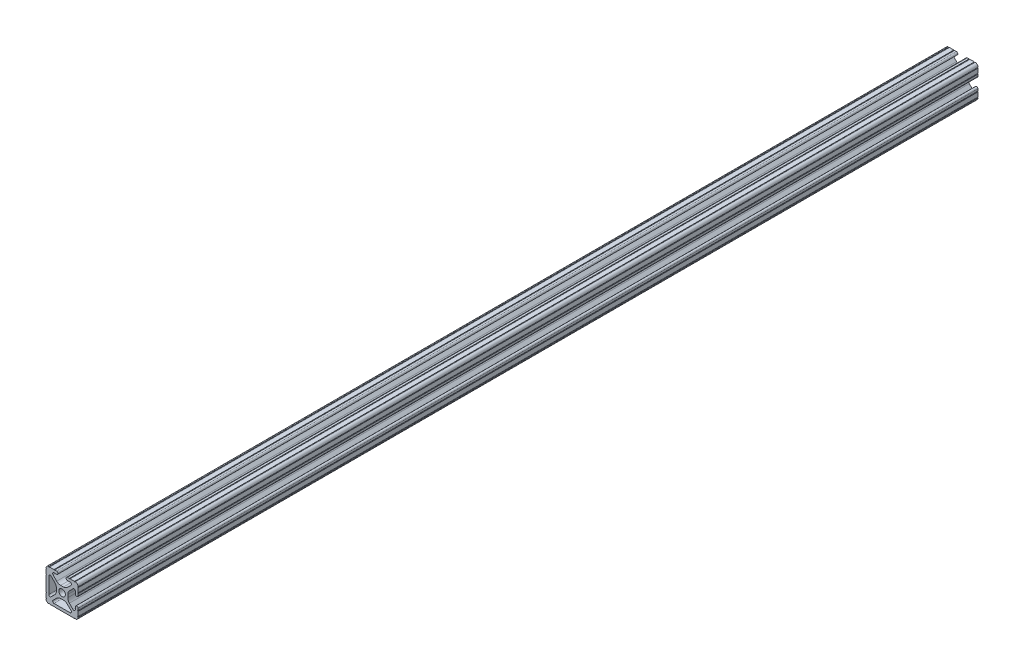
from build123d import *

# Parameters (mm, degrees)
SKETCH3_R      = 2.6035
EXTRUDE1_DEPTH = 355.6


with BuildPart() as part:
    # Sketch3 → Extrude1 (new, symmetric)
    with BuildSketch(Plane.XY):
        with BuildLine():
            Line((-1.115277175, 4.5085), (1.115277175, 4.5085))
            ThreePointArc((1.115277175, 4.5085), (2.806584872, 4.844922018), (4.240406305, 5.80297087))
            Line((4.240406305, 5.80297087), (7.119225992, 8.681790557))
            ThreePointArc((7.119225992, 8.681790557), (7.348862413, 9.836250802), (6.370158275, 10.4902))
            Line((6.370158275, 10.4902), (4.3434, 10.4902))
            ThreePointArc((4.3434, 10.4902), (3.2385, 11.5951), (4.3434, 12.7))
            Line((4.3434, 12.7), (5.738786846, 12.7))
            ThreePointArc((5.738786846, 12.7), (6.054472561, 12.384314286), (6.370158275, 12.7))
            Line((6.370158275, 12.7), (9.858828571, 12.7))
            ThreePointArc((9.858828571, 12.7), (10.174514286, 12.384314286), (10.4902, 12.7))
            ThreePointArc((10.4902, 12.7), (12.052764565, 12.052764565), (12.7, 10.4902))
            ThreePointArc((12.7, 10.4902), (12.384314286, 10.174514286), (12.7, 9.858828571))
            Line((12.7, 9.858828571), (12.7, 6.370158275))
            ThreePointArc((12.7, 6.370158275), (12.384314286, 6.054472561), (12.7, 5.738786846))
            Line((12.7, 5.738786846), (12.7, 4.3434))
            ThreePointArc((12.7, 4.3434), (11.5951, 3.2385), (10.4902, 4.3434))
            Line((10.4902, 4.3434), (10.4902, 6.370158275))
            ThreePointArc((10.4902, 6.370158275), (9.836250802, 7.348862413), (8.681790557, 7.119225992))
            Line((8.681790557, 7.119225992), (5.80297087, 4.240406305))
            ThreePointArc((5.80297087, 4.240406305), (4.844922018, 2.806584872), (4.5085, 1.115277175))
            Line((4.5085, 1.115277175), (4.5085, -1.115277175))
            ThreePointArc((4.5085, -1.115277175), (4.844922018, -2.806584872), (5.80297087, -4.240406305))
            Line((5.80297087, -4.240406305), (8.681790557, -7.119225992))
            ThreePointArc((8.681790557, -7.119225992), (9.836250802, -7.348862413), (10.4902, -6.370158275))
            Line((10.4902, -6.370158275), (10.4902, -4.3434))
            ThreePointArc((10.4902, -4.3434), (11.5951, -3.2385), (12.7, -4.3434))
            Line((12.7, -4.3434), (12.7, -5.738786846))
            ThreePointArc((12.7, -5.738786846), (12.384314286, -6.054472561), (12.7, -6.370158275))
            Line((12.7, -6.370158275), (12.7, -9.858828571))
            ThreePointArc((12.7, -9.858828571), (12.384314286, -10.174514286), (12.7, -10.4902))
            ThreePointArc((12.7, -10.4902), (12.052764565, -12.052764565), (10.4902, -12.7))
            ThreePointArc((10.4902, -12.7), (10.174514286, -12.384314286), (9.858828571, -12.7))
            Line((9.858828571, -12.7), (6.370158275, -12.7))
            ThreePointArc((6.370158275, -12.7), (6.054472561, -12.384314286), (5.738786846, -12.7))
            Line((5.738786846, -12.7), (4.3434, -12.7))
            Line((4.3434, -12.7), (-5.738786846, -12.7))
            ThreePointArc((-5.738786846, -12.7), (-6.054472561, -12.384314286), (-6.370158275, -12.7))
            Line((-6.370158275, -12.7), (-9.858828571, -12.7))
            ThreePointArc((-9.858828571, -12.7), (-10.174514286, -12.384314286), (-10.4902, -12.7))
            ThreePointArc((-10.4902, -12.7), (-12.052764565, -12.052764565), (-12.7, -10.4902))
            ThreePointArc((-12.7, -10.4902), (-12.384314286, -10.174514286), (-12.7, -9.858828571))
            Line((-12.7, -9.858828571), (-12.7, -6.370158275))
            ThreePointArc((-12.7, -6.370158275), (-12.384314286, -6.054472561), (-12.7, -5.738786846))
            Line((-12.7, -5.738786846), (-12.7, 0))
            Line((-12.7, 0), (-12.7, 5.738786846))
            ThreePointArc((-12.7, 5.738786846), (-12.384314286, 6.054472561), (-12.7, 6.370158275))
            Line((-12.7, 6.370158275), (-12.7, 9.858828571))
            ThreePointArc((-12.7, 9.858828571), (-12.384314286, 10.174514286), (-12.7, 10.4902))
            ThreePointArc((-12.7, 10.4902), (-12.052764565, 12.052764565), (-10.4902, 12.7))
            ThreePointArc((-10.4902, 12.7), (-10.174514286, 12.384314286), (-9.858828571, 12.7))
            Line((-9.858828571, 12.7), (-6.370158275, 12.7))
            ThreePointArc((-6.370158275, 12.7), (-6.054472561, 12.384314286), (-5.738786846, 12.7))
            Line((-5.738786846, 12.7), (-4.3434, 12.7))
            ThreePointArc((-4.3434, 12.7), (-3.2385, 11.5951), (-4.3434, 10.4902))
            Line((-4.3434, 10.4902), (-6.370158275, 10.4902))
            ThreePointArc((-6.370158275, 10.4902), (-7.348862413, 9.836250802), (-7.119225992, 8.681790557))
            Line((-7.119225992, 8.681790557), (-4.240406305, 5.80297087))
            ThreePointArc((-4.240406305, 5.80297087), (-2.806584872, 4.844922018), (-1.115277175, 4.5085))
        make_face()
        Circle(SKETCH3_R, mode=Mode.SUBTRACT)
        with BuildLine():
            Line((-4.5085, -1.115277175), (-4.5085, 1.115277175))
            ThreePointArc((-4.5085, 1.115277175), (-4.844922018, 2.806584872), (-5.80297087, 4.240406305))
            Line((-5.80297087, 4.240406305), (-8.681790557, 7.119225992))
            ThreePointArc((-8.681790557, 7.119225992), (-9.836250802, 7.348862413), (-10.4902, 6.370158275))
            Line((-10.4902, 6.370158275), (-10.4902, 0))
            Line((-10.4902, 0), (-10.4902, -6.370158275))
            ThreePointArc((-10.4902, -6.370158275), (-9.836250802, -7.348862413), (-8.681790557, -7.119225992))
            Line((-8.681790557, -7.119225992), (-5.80297087, -4.240406305))
            ThreePointArc((-5.80297087, -4.240406305), (-4.844922018, -2.806584872), (-4.5085, -1.115277175))
        make_face(mode=Mode.SUBTRACT)
        with BuildLine():
            Line((4.240406305, -5.80297087), (7.119225992, -8.681790557))
            ThreePointArc((7.119225992, -8.681790557), (7.348862413, -9.836250802), (6.370158275, -10.4902))
            Line((6.370158275, -10.4902), (4.3434, -10.4902))
            Line((4.3434, -10.4902), (-6.370158275, -10.4902))
            ThreePointArc((-6.370158275, -10.4902), (-7.348862413, -9.836250802), (-7.119225992, -8.681790557))
            Line((-7.119225992, -8.681790557), (-4.240406305, -5.80297087))
            ThreePointArc((-4.240406305, -5.80297087), (-2.806584872, -4.844922018), (-1.115277175, -4.5085))
            Line((-1.115277175, -4.5085), (1.115277175, -4.5085))
            ThreePointArc((1.115277175, -4.5085), (2.806584872, -4.844922018), (4.240406305, -5.80297087))
        make_face(mode=Mode.SUBTRACT)
    extrude(amount=EXTRUDE1_DEPTH, both=True)


solid = part.part
